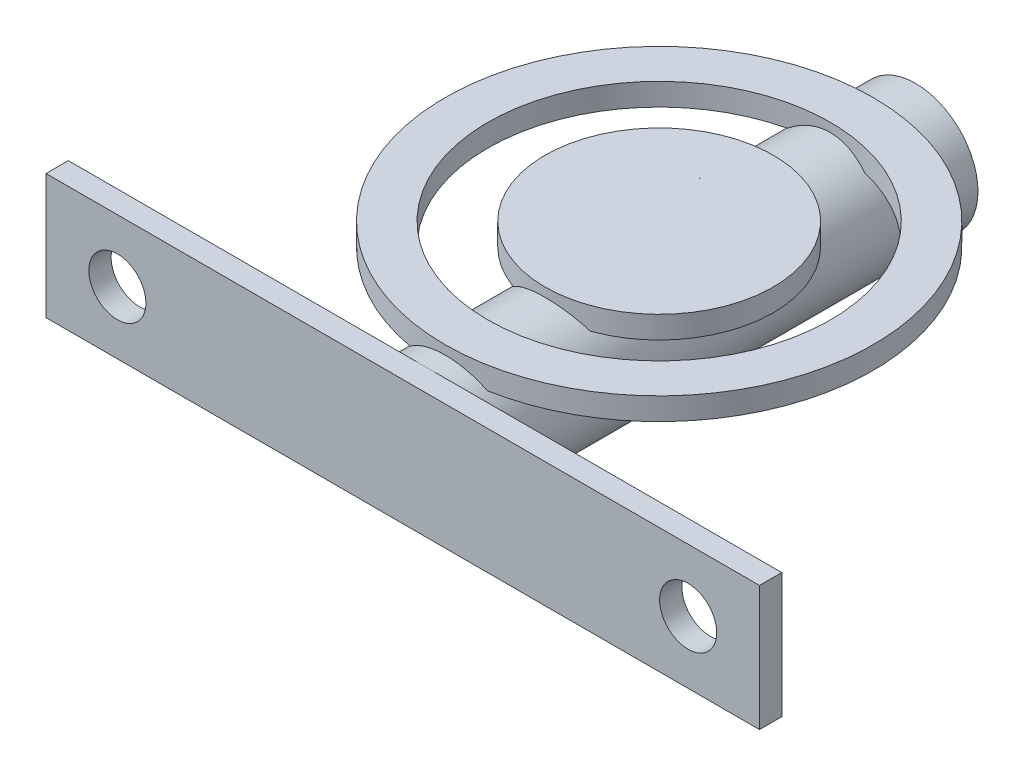
from build123d import *

# Parameters (mm, degrees)
SKETCH_1_R           = 3.5
EXTRUDE_1_DEPTH      = 27.5
SKETCH_2_R           = 2.25
CUT_EXTRUDE_1_DEPTH  = 8.2
SKETCH_3_W           = 40
SKETCH_3_H           = 7
EXTRUDE_2_DEPTH      = 1.25
SKETCH_3_4_R         = 1.6
CUT_EXTRUDE_3_DEPTH  = 1.5
EXTRUDE_3_DEPTH      = 0.5
EXTRUDE_3_DEPTH_BACK = 0.75
SKETCH_6_R           = 12
SKETCH_6_R_2         = 9.6
SKETCH_6_R_3         = 6.4


with BuildPart() as part:
    # 草图1 → 凸台-拉伸1 (new body)
    with BuildSketch(Plane.XY):
        Circle(SKETCH_1_R)
    extrude(amount=EXTRUDE_1_DEPTH)

    # 草图2 → 切除-拉伸1 (cut)
    with BuildSketch(Plane(origin=(0, 0, 0), x_dir=(-1, 0, 0), z_dir=(0, 0, -1))):
        Circle(SKETCH_2_R)
    extrude(amount=-CUT_EXTRUDE_1_DEPTH, mode=Mode.SUBTRACT)

    # 草图3 → 凸台-拉伸2 (add)
    with BuildSketch(Plane.XY.offset(27.5)):
        Rectangle(SKETCH_3_W, SKETCH_3_H)
    extrude(amount=EXTRUDE_2_DEPTH)

    # 草图3<4> → 切除-拉伸3 (cut)
    with BuildSketch(Plane.XY.offset(27.5)):
        with Locations((-16, 0)):
            Circle(SKETCH_3_4_R)
        with Locations((16, 0)):
            Circle(SKETCH_3_4_R)
    extrude(amount=CUT_EXTRUDE_3_DEPTH, mode=Mode.SUBTRACT)

    # 草图6 → 凸台-拉伸3 (add, two sides: drawn at the far end of the back side and taken through both)
    # profile 1 of 2: a face of its own
    with BuildSketch(Plane(origin=(0, 3.5, 0), x_dir=(1, 0, 0), z_dir=(0, 1, 0)).offset(-EXTRUDE_3_DEPTH_BACK)):
        with Locations((0, -14.375)):
            Circle(SKETCH_6_R)
        with Locations((0, -14.375)):
            Circle(SKETCH_6_R_2, mode=Mode.SUBTRACT)
    # profile 2 of 2: a face of its own
    with BuildSketch(Plane(origin=(0, 3.5, 0), x_dir=(1, 0, 0), z_dir=(0, 1, 0)).offset(-EXTRUDE_3_DEPTH_BACK)):
        with Locations((0, -14.375)):
            Circle(SKETCH_6_R_3)
    extrude(amount=EXTRUDE_3_DEPTH + EXTRUDE_3_DEPTH_BACK)


solid = part.part
